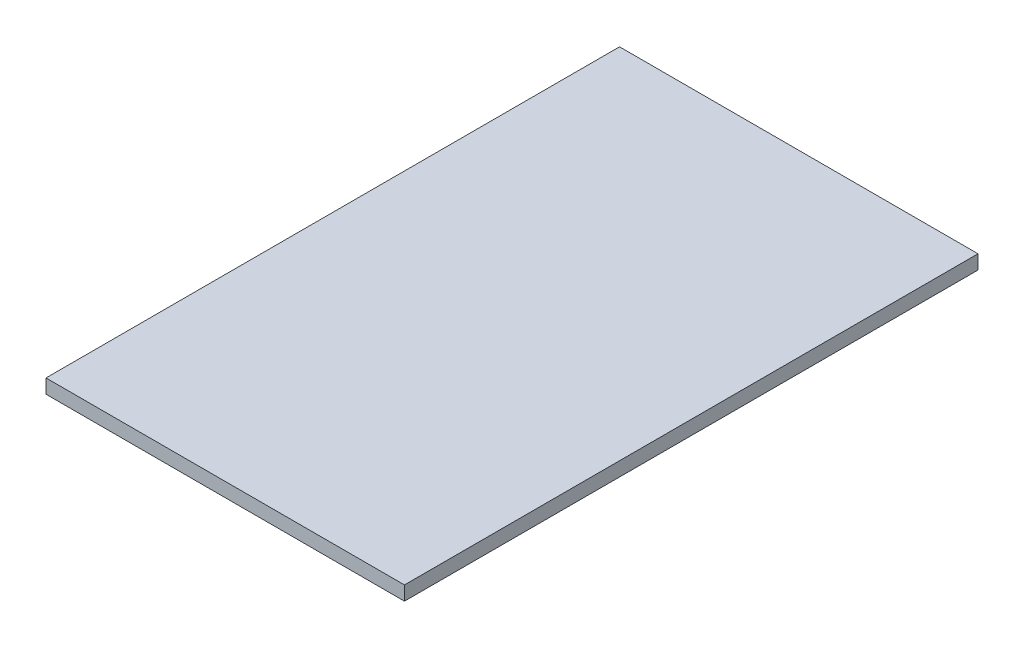
from build123d import *

# Parameters (mm, degrees)
SKETCH1_W           = 254
SKETCH1_H           = 406.4
BOSS_EXTRUDE1_DEPTH = 10


with BuildPart() as part:
    # Sketch1 → Boss-Extrude1 (new body)
    with BuildSketch(Plane(origin=(0, 0, 0), x_dir=(1, 0, 0), z_dir=(0, 1, 0))):
        Rectangle(SKETCH1_W, SKETCH1_H)
    extrude(amount=BOSS_EXTRUDE1_DEPTH)


solid = part.part
